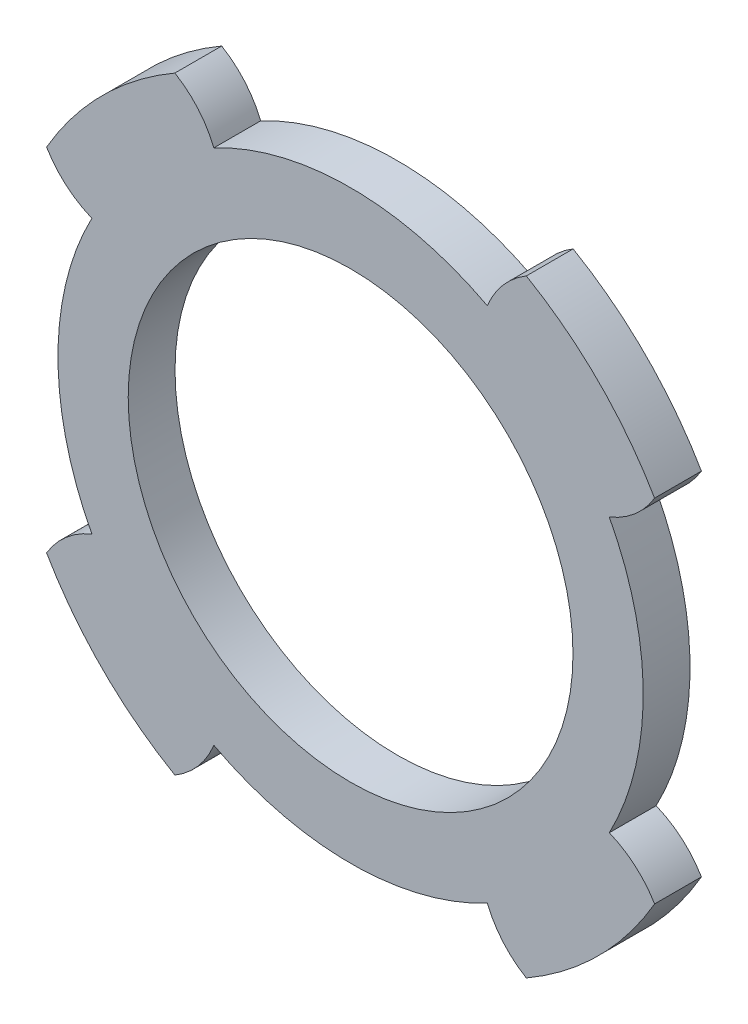
from build123d import *
from build123d.topology import SkipClean

# Parameters (mm, degrees)
SKETCH3_R             = 4
BOSS_EXTRUDE1_DEPTH   = 11
BOSS_EXTRUDE1_2_DEPTH = 11
BOSS_EXTRUDE1_3_DEPTH = 11
BOSS_EXTRUDE1_4_DEPTH = 11
BOSS_EXTRUDE6_START   = 2
SKETCH6_R             = 9.5
BOSS_EXTRUDE6_DEPTH   = 2
SKETCH7_R             = 19.191160133
CUT_EXTRUDE1_DEPTH    = 11


with BuildPart() as part:
    # Sketch3 → Boss-Extrude1 (new body)
    with BuildSketch(Plane(origin=(0, 0, 15), x_dir=(-1, 0, 0), z_dir=(0, 0, -1))):
        with Locations((-9.545941546, 9.545941546)):
            Circle(SKETCH3_R)
    extrude(amount=BOSS_EXTRUDE1_DEPTH)



with BuildPart() as body_2:
    # Sketch3 → Boss-Extrude1 2 (new body)
    with BuildSketch(Plane(origin=(0, 0, 15), x_dir=(-1, 0, 0), z_dir=(0, 0, -1))):
        with Locations((9.545941546, 9.545941546)):
            Circle(SKETCH3_R)
    extrude(amount=BOSS_EXTRUDE1_2_DEPTH)


with BuildPart() as body_3:
    # Sketch3 → Boss-Extrude1 3 (new body)
    with BuildSketch(Plane(origin=(0, 0, 15), x_dir=(-1, 0, 0), z_dir=(0, 0, -1))):
        with Locations((9.545941546, -9.545941546)):
            Circle(SKETCH3_R)
    extrude(amount=BOSS_EXTRUDE1_3_DEPTH)


with BuildPart() as body_4:
    # Sketch3 → Boss-Extrude1 4 (new body)
    with BuildSketch(Plane(origin=(0, 0, 15), x_dir=(-1, 0, 0), z_dir=(0, 0, -1))):
        with Locations((-9.545941546, -9.545941546)):
            Circle(SKETCH3_R)
    extrude(amount=BOSS_EXTRUDE1_4_DEPTH)


with BuildPart() as part_1:
    with SkipClean():  # the faces are left unmerged after this step: merging them gives an invalid solid
        add(part.part)

        add(body_2.part)  # Boss-Extrude6 merges body 2

        add(body_3.part)  # Boss-Extrude6 merges body 3

        add(body_4.part)  # Boss-Extrude6 merges body 4
        # Sketch6 → Boss-Extrude6 (add)
        with BuildSketch(Plane.XY.offset(15).offset(BOSS_EXTRUDE6_START)):
            with BuildLine():
                ThreePointArc((-5.840211131, 11.051784197), (-6.514660932, 12.155795534), (-7.506206096, 12.986795988))
                ThreePointArc((-7.506206096, 12.986795988), (-10.606601718, 10.606601718), (-12.986795988, 7.506206096))
                ThreePointArc((-12.986795988, 7.506206096), (-12.155795534, 6.514660932), (-11.051784197, 5.840211131))
                ThreePointArc((-11.051784197, 5.840211131), (-12.5, 0), (-11.051784197, -5.840211131))
                ThreePointArc((-11.051784197, -5.840211131), (-12.155795534, -6.514660932), (-12.986795988, -7.506206096))
                ThreePointArc((-12.986795988, -7.506206096), (-10.606601718, -10.606601718), (-7.506206096, -12.986795988))
                ThreePointArc((-7.506206096, -12.986795988), (-6.514660932, -12.155795534), (-5.840211131, -11.051784197))
                ThreePointArc((-5.840211131, -11.051784197), (0, -12.5), (5.840211131, -11.051784197))
                ThreePointArc((5.840211131, -11.051784197), (6.514660932, -12.155795534), (7.506206096, -12.986795988))
                ThreePointArc((7.506206096, -12.986795988), (10.606601718, -10.606601718), (12.986795988, -7.506206096))
                ThreePointArc((12.986795988, -7.506206096), (12.155795534, -6.514660932), (11.051784197, -5.840211131))
                ThreePointArc((11.051784197, -5.840211131), (12.5, 0), (11.051784197, 5.840211131))
                ThreePointArc((11.051784197, 5.840211131), (12.155795534, 6.514660932), (12.986795988, 7.506206096))
                ThreePointArc((12.986795988, 7.506206096), (10.606601718, 10.606601718), (7.506206096, 12.986795988))
                ThreePointArc((7.506206096, 12.986795988), (6.514660932, 12.155795534), (5.840211131, 11.051784197))
                ThreePointArc((5.840211131, 11.051784197), (0, 12.5), (-5.840211131, 11.051784197))
            make_face()
            Circle(SKETCH6_R, mode=Mode.SUBTRACT)
        extrude(amount=-BOSS_EXTRUDE6_DEPTH)

    # Sketch7 → Cut-Extrude1 (cut)
    with BuildSketch(Plane(origin=(0, 0, 4), x_dir=(-1, 0, 0), z_dir=(0, 0, -1))):
        Circle(SKETCH7_R)
    extrude(amount=-CUT_EXTRUDE1_DEPTH, mode=Mode.SUBTRACT)


solid = part_1.part
